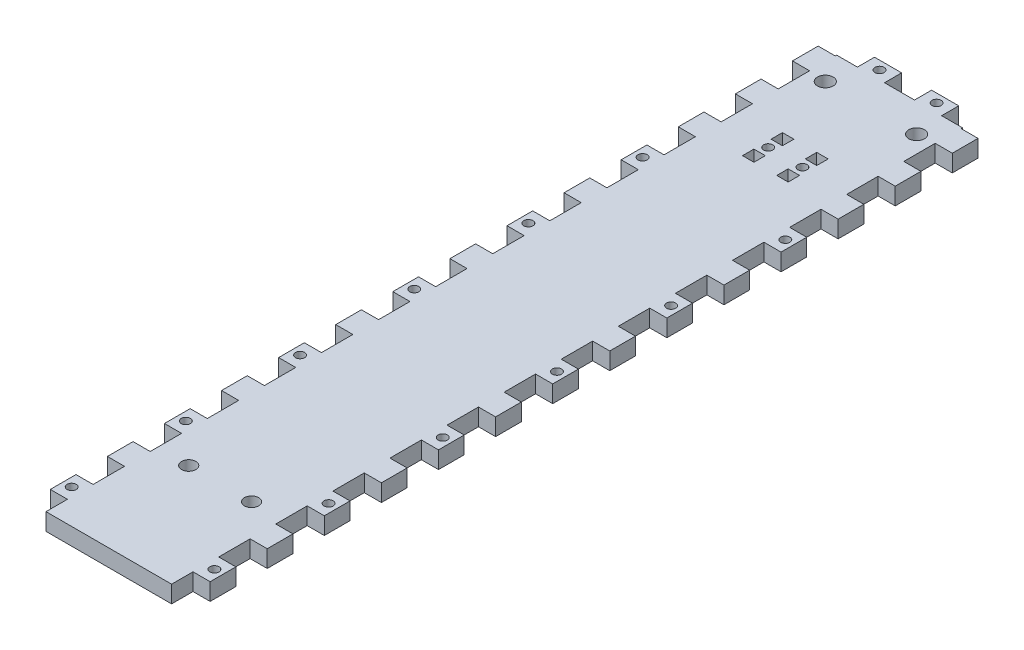
from build123d import *

# Parameters (mm, degrees)
SKETCH1_W               = 44
SKETCH1_H               = 277
SKETCH1_W_2             = 6
SKETCH1_H_2             = 9
SKETCH1_W_3             = 9.5
SKETCH1_H_3             = 6
BOSS_EXTRUDE1_DEPTH     = 6
CUT_EXTRUDE1_DEPTH      = 288.445647036
CUT_EXTRUDE1_DEPTH_BACK = 288.445647036
SKETCH2_R               = 2.75
CUT_EXTRUDE2_DEPTH      = 288.445647036
CUT_EXTRUDE2_DEPTH_BACK = 288.445647036
SKETCH3_R               = 1.6
SKETCH3_W               = 4
SKETCH3_H               = 4
CUT_EXTRUDE3_DEPTH      = 288.445647036
CUT_EXTRUDE3_DEPTH_BACK = 288.445647036
SKETCH4_R               = 2.5
CUT_EXTRUDE4_DEPTH      = 288.445647036
CUT_EXTRUDE4_DEPTH_BACK = 288.445647036
SKETCH5_R               = 1.6


with BuildPart() as part:
    # Sketch1 → Boss-Extrude1 (new body)
    with BuildSketch(Plane(origin=(0, 0, 0), x_dir=(1, 0, 0), z_dir=(0, 1, 0))):
        with Locations((22, 138.5)):
            Rectangle(SKETCH1_W, SKETCH1_H)
        with Locations((-3, 12)):
            Rectangle(SKETCH1_W_2, SKETCH1_H_2)
        with Locations((-3, 32)):
            Rectangle(SKETCH1_W_2, SKETCH1_H_2)
        with Locations((-3, 52)):
            Rectangle(SKETCH1_W_2, SKETCH1_H_2)
        with Locations((-3, 72)):
            Rectangle(SKETCH1_W_2, SKETCH1_H_2)
        with Locations((-3, 92)):
            Rectangle(SKETCH1_W_2, SKETCH1_H_2)
        with Locations((-3, 112)):
            Rectangle(SKETCH1_W_2, SKETCH1_H_2)
        with Locations((-3, 132)):
            Rectangle(SKETCH1_W_2, SKETCH1_H_2)
        with Locations((-3, 152)):
            Rectangle(SKETCH1_W_2, SKETCH1_H_2)
        with Locations((-3, 172)):
            Rectangle(SKETCH1_W_2, SKETCH1_H_2)
        with Locations((-3, 192)):
            Rectangle(SKETCH1_W_2, SKETCH1_H_2)
        with Locations((-3, 212)):
            Rectangle(SKETCH1_W_2, SKETCH1_H_2)
        with Locations((-3, 232)):
            Rectangle(SKETCH1_W_2, SKETCH1_H_2)
        with Locations((-3, 252)):
            Rectangle(SKETCH1_W_2, SKETCH1_H_2)
        with Locations((-3, 272)):
            Rectangle(SKETCH1_W_2, SKETCH1_H_2)
        with Locations((12, 280)):
            Rectangle(SKETCH1_W_3, SKETCH1_H_3)
        with Locations((32, 280)):
            Rectangle(SKETCH1_W_3, SKETCH1_H_3)
        with Locations((47, 272)):
            Rectangle(SKETCH1_W_2, SKETCH1_H_2)
        with Locations((47, 252)):
            Rectangle(SKETCH1_W_2, SKETCH1_H_2)
        with Locations((47, 232)):
            Rectangle(SKETCH1_W_2, SKETCH1_H_2)
        with Locations((47, 212)):
            Rectangle(SKETCH1_W_2, SKETCH1_H_2)
        with Locations((47, 192)):
            Rectangle(SKETCH1_W_2, SKETCH1_H_2)
        with Locations((47, 172)):
            Rectangle(SKETCH1_W_2, SKETCH1_H_2)
        with Locations((47, 152)):
            Rectangle(SKETCH1_W_2, SKETCH1_H_2)
        with Locations((47, 132)):
            Rectangle(SKETCH1_W_2, SKETCH1_H_2)
        with Locations((47, 112)):
            Rectangle(SKETCH1_W_2, SKETCH1_H_2)
        with Locations((47, 92)):
            Rectangle(SKETCH1_W_2, SKETCH1_H_2)
        with Locations((47, 72)):
            Rectangle(SKETCH1_W_2, SKETCH1_H_2)
        with Locations((47, 52)):
            Rectangle(SKETCH1_W_2, SKETCH1_H_2)
        with Locations((47, 32)):
            Rectangle(SKETCH1_W_2, SKETCH1_H_2)
        with Locations((47, 12)):
            Rectangle(SKETCH1_W_2, SKETCH1_H_2)
    extrude(amount=BOSS_EXTRUDE1_DEPTH)

    # Sketch2 → Cut-Extrude1 (cut, two sides: drawn at the far end of the back side and taken through both)
    with BuildSketch(Plane(origin=(0, 6, 0), x_dir=(1, 0, 0), z_dir=(0, 1, 0)).offset(-CUT_EXTRUDE1_DEPTH_BACK)):
        with Locations(Location((6, 267, 0), (0, 0, 270))):
            Circle(SKETCH2_R)
        with Locations(Location((38, 267, 0), (0, 0, 270))):
            Circle(SKETCH2_R)
    extrude(amount=CUT_EXTRUDE1_DEPTH + CUT_EXTRUDE1_DEPTH_BACK, mode=Mode.SUBTRACT)

    # Sketch3 → Cut-Extrude2 (cut, two sides: drawn at the far end of the back side and taken through both)
    with BuildSketch(Plane(origin=(0, 6, 0), x_dir=(1, 0, 0), z_dir=(0, 1, 0)).offset(-CUT_EXTRUDE2_DEPTH_BACK)):
        with Locations(Location((16, 237, 0), (0, 0, 270))):
            Circle(SKETCH3_R)
        with Locations(Location((28, 237, 0), (0, 0, 270))):
            Circle(SKETCH3_R)
        with Locations((16, 242)):
            Rectangle(SKETCH3_W, SKETCH3_H)
        with Locations((16, 232)):
            Rectangle(SKETCH3_W, SKETCH3_H)
        with Locations((28, 242)):
            Rectangle(SKETCH3_W, SKETCH3_H)
        with Locations((28, 232)):
            Rectangle(SKETCH3_W, SKETCH3_H)
    extrude(amount=CUT_EXTRUDE2_DEPTH + CUT_EXTRUDE2_DEPTH_BACK, mode=Mode.SUBTRACT)

    # Sketch4 → Cut-Extrude3 (cut, two sides: drawn at the far end of the back side and taken through both)
    with BuildSketch(Plane(origin=(0, 6, 0), x_dir=(1, 0, 0), z_dir=(0, 1, 0)).offset(-CUT_EXTRUDE3_DEPTH_BACK)):
        with Locations(Location((33, 39, 0), (0, 0, 270))):
            Circle(SKETCH4_R)
        with Locations(Location((11, 39, 0), (0, 0, 270))):
            Circle(SKETCH4_R)
    extrude(amount=CUT_EXTRUDE3_DEPTH + CUT_EXTRUDE3_DEPTH_BACK, mode=Mode.SUBTRACT)

    # Sketch5 → Cut-Extrude4 (cut, two sides: drawn at the far end of the back side and taken through both)
    with BuildSketch(Plane(origin=(0, 6, 0), x_dir=(1, 0, 0), z_dir=(0, 1, 0)).offset(-CUT_EXTRUDE4_DEPTH_BACK)):
        with Locations(Location((-3, 12, 0), (0, 0, 270))):
            Circle(SKETCH5_R)
        with Locations(Location((47, 12, 0), (0, 0, 270))):
            Circle(SKETCH5_R)
        with Locations(Location((47, 52, 0), (0, 0, 270))):
            Circle(SKETCH5_R)
        with Locations(Location((47, 92, 0), (0, 0, 270))):
            Circle(SKETCH5_R)
        with Locations(Location((47, 132, 0), (0, 0, 270))):
            Circle(SKETCH5_R)
        with Locations(Location((47, 172, 0), (0, 0, 270))):
            Circle(SKETCH5_R)
        with Locations(Location((47, 212, 0), (0, 0, 270))):
            Circle(SKETCH5_R)
        with Locations(Location((-3, 52, 0), (0, 0, 270))):
            Circle(SKETCH5_R)
        with Locations(Location((-3, 92, 0), (0, 0, 270))):
            Circle(SKETCH5_R)
        with Locations(Location((-3, 132, 0), (0, 0, 270))):
            Circle(SKETCH5_R)
        with Locations(Location((-3, 172, 0), (0, 0, 270))):
            Circle(SKETCH5_R)
        with Locations(Location((-3, 212, 0), (0, 0, 270))):
            Circle(SKETCH5_R)
        with Locations(Location((32, 280, 0), (0, 0, 270))):
            Circle(SKETCH5_R)
        with Locations(Location((12, 280, 0), (0, 0, 270))):
            Circle(SKETCH5_R)
    extrude(amount=CUT_EXTRUDE4_DEPTH + CUT_EXTRUDE4_DEPTH_BACK, mode=Mode.SUBTRACT)


solid = part.part
